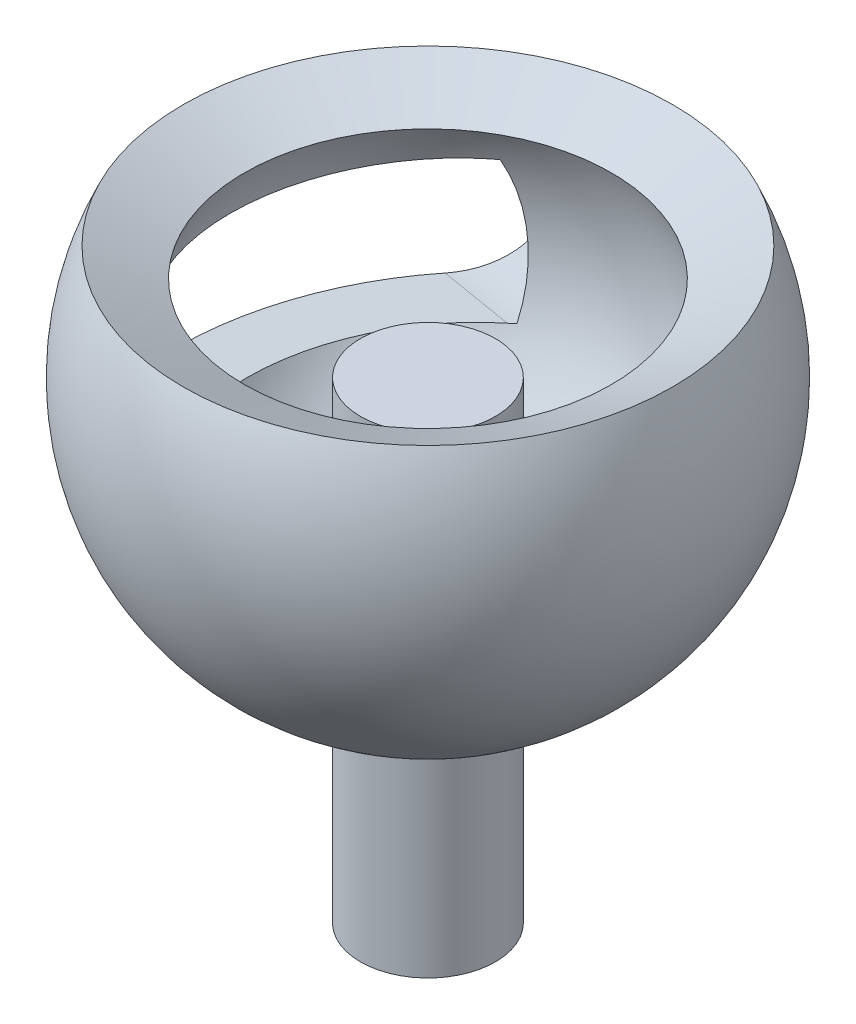
from build123d import *

# Parameters (mm, degrees)
ESQUISSE2_R             = 2
BOSS_EXTRU_1_DEPTH      = 14
ENL_V_MAT_EXTRU_1_DEPTH = 7


with BuildPart() as part:
    # Esquisse1 → Révolution1 (revolve)
    with BuildSketch(Plane.XY, mode=Mode.PRIVATE) as r_volution1_sk:
        with BuildLine():
            Line((-7.250462296, 3.380946094), (-5.437846722, 2.53570957))
            ThreePointArc((-5.437846722, 2.53570957), (-5.060348675, -3.22379765), (0, -6))
            Line((0, -6), (0, -8))
            ThreePointArc((0, -8), (-6.747131567, -4.298396867), (-7.250462296, 3.380946094))
        make_face()
    revolve(r_volution1_sk.sketch.rotate(Axis((0, 0, 0), (0, -1, 0)), 270), axis=Axis((0, 0, 0), (0, -1, 0)))

    # Esquisse2 → Boss.-Extru.1 (add)
    with BuildSketch(Plane(origin=(0, 0, 0), x_dir=(1, 0, 0), z_dir=(0, 1, 0))):
        with Locations(Location((0, 0, 0), (0, 0, 270))):
            Circle(ESQUISSE2_R)
    extrude(amount=-BOSS_EXTRU_1_DEPTH)

    # Esquisse3 → Enlèv. mat.-Extru.1 (cut)
    with BuildSketch(Plane(origin=(-10.393608687, -1.299249719, -2.818585808), x_dir=(-0.25784022856565836, -0.03223123504955077, 0.9656498143842775), z_dir=(-0.9581923956348063, -0.11977853300162247, -0.2598469472201095))):
        with BuildLine():
            Line((-4, 2), (4, 2))
            ThreePointArc((4, 2), (6, 0), (4, -2))
            Line((4, -2), (-4, -2))
            ThreePointArc((-4, -2), (-6, 0), (-4, 2))
        make_face()
    extrude(amount=-ENL_V_MAT_EXTRU_1_DEPTH, mode=Mode.SUBTRACT)


solid = part.part
